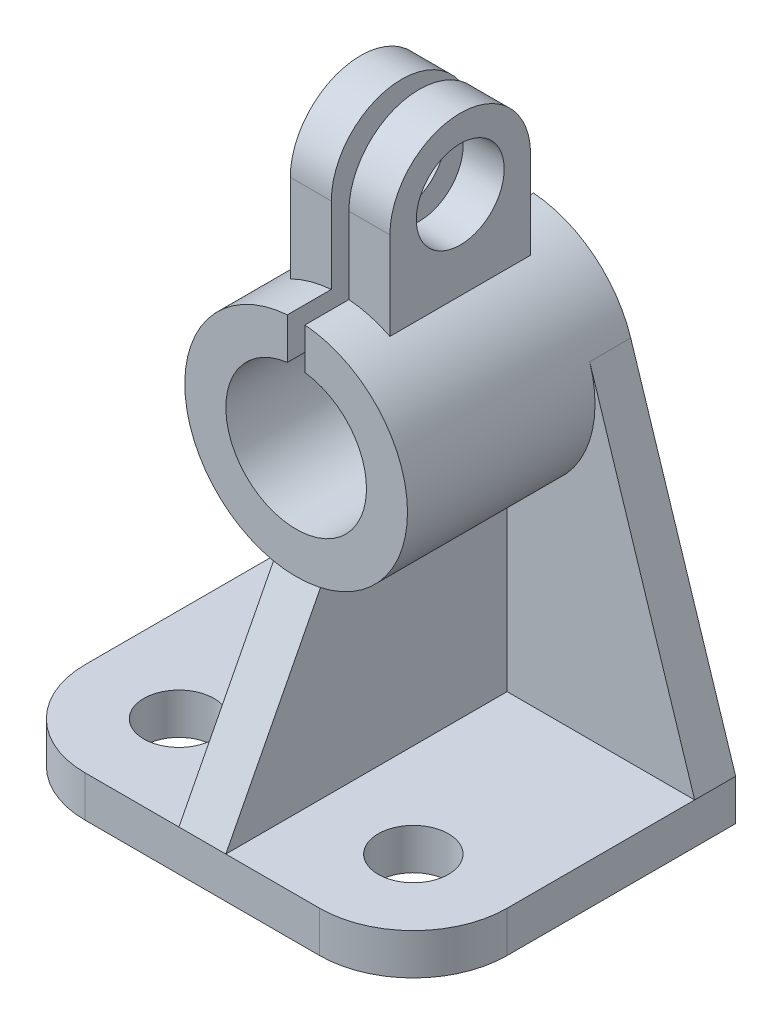
from build123d import *

# Parameters (mm, degrees)
SKETCH1_W                  = 72
SKETCH1_H                  = 7
BOSS_EXTRUDE1_DEPTH        = 55
BOSS_EXTRUDE2_DEPTH        = 7
BOSS_EXTRUDE3_DEPTH        = 39
BOSS_EXTRUDE4_START        = 7.5
BOSS_EXTRUDE4_DEPTH        = 24
FILLET1_RADIUS             = 12
FILLET1_LENGTH             = 7
FILLET2_RADIUS             = 12
FILLET2_LENGTH             = 7
F_1_0MM_DOWEL_HOLE1_D      = 15
RIB1_REACH                 = 119.589
SKETCH4_WALL_W             = 272.06418258
SKETCH4_WALL_H             = 8
FILLET3_R                  = 16
F_12_0MM_DOWEL_HOLE1_D     = 12
F_12_0MM_DOWEL_HOLE1_DEPTH = 7


with BuildPart() as part:
    # Sketch1 → Boss-Extrude1 (new body)
    with BuildSketch(Plane.XY):
        Rectangle(SKETCH1_W, SKETCH1_H)
    extrude(amount=BOSS_EXTRUDE1_DEPTH)

    # Sketch1<3> → Boss-Extrude2 (add)
    with BuildSketch(Plane.XY):
        with BuildLine():
            ThreePointArc((19, 53.5), (-2.93819909, 34.728559296), (-18.091261695, 59.305708421))
            Line((-18.091261695, 59.305708421), (-36, 3.5))
            Line((-36, 3.5), (36, 3.5))
            Line((36, 3.5), (18.091261695, 59.305708421))
            ThreePointArc((18.091261695, 59.305708421), (18.771440704, 56.43819909), (19, 53.5))
        make_face()
    extrude(amount=BOSS_EXTRUDE2_DEPTH)

    # Sketch1<4> → Boss-Extrude3 (add)
    with BuildSketch(Plane.XY):
        with BuildLine():
            ThreePointArc((-8.5, 70.492645468), (-14.424308987, 65.866863395), (-18.091261695, 59.305708421))
            ThreePointArc((-18.091261695, 59.305708421), (-2.93819909, 34.728559296), (19, 53.5))
            ThreePointArc((19, 53.5), (18.771440704, 56.43819909), (18.091261695, 59.305708421))
            ThreePointArc((18.091261695, 59.305708421), (14.424308987, 65.866863395), (8.5, 70.492645468))
            ThreePointArc((8.5, 70.492645468), (5.093989215, 71.80440586), (1.5, 72.440696925))
            Line((1.5, 72.440696925), (1.5, 65.4058809))
            ThreePointArc((1.5, 65.4058809), (9, 61.437253933), (12, 53.5))
            ThreePointArc((12, 53.5), (-7.937253933, 44.5), (-1.5, 65.4058809))
            Line((-1.5, 65.4058809), (-1.5, 72.440696925))
            ThreePointArc((-1.5, 72.440696925), (-5.093989215, 71.80440586), (-8.5, 70.492645468))
        make_face()
    extrude(amount=BOSS_EXTRUDE3_DEPTH)

    # Sketch1<5> → Boss-Extrude4 (add)
    with BuildSketch(Plane.XY.offset(BOSS_EXTRUDE4_START)):
        with BuildLine():
            Line((1.5, 97.5), (1.5, 72.440696925))
            ThreePointArc((1.5, 72.440696925), (5.093989215, 71.80440586), (8.5, 70.492645468))
            Line((8.5, 70.492645468), (8.5, 97.5))
            Line((8.5, 97.5), (1.5, 97.5))
        make_face()
        with BuildLine():
            Line((-8.5, 97.5), (-8.5, 70.492645468))
            ThreePointArc((-8.5, 70.492645468), (-5.093989215, 71.80440586), (-1.5, 72.440696925))
            Line((-1.5, 72.440696925), (-1.5, 97.5))
            Line((-1.5, 97.5), (-8.5, 97.5))
        make_face()
    extrude(amount=BOSS_EXTRUDE4_DEPTH)

    # Fillet1: full round fillet: the end face becomes a half cylinder, R = half its width
    fillet1_face = Plane((5, 97.5, 19.5), x_dir=(1, 0, 0), z_dir=(0, 1, 0))  # on the end face: x along it, z out of the body
    fillet1_slab = fillet1_face.offset(-FILLET1_RADIUS / 2) * Box(FILLET1_LENGTH, 2 * FILLET1_RADIUS, FILLET1_RADIUS, mode=Mode.PRIVATE)  # the body's end, R deep
    fillet1_round = Plane((5, 85.5, 19.5), x_dir=(0, 1, 0), z_dir=(1, 0, 0)) * Cylinder(FILLET1_RADIUS, FILLET1_LENGTH, mode=Mode.PRIVATE)  # its axis R under the face
    add(fillet1_slab - fillet1_round, mode=Mode.SUBTRACT)

    # Fillet2: full round fillet: the end face becomes a half cylinder, R = half its width
    fillet2_face = Plane((-5, 97.5, 19.5), x_dir=(-1, 0, 0), z_dir=(0, 1, 0))  # on the end face: x along it, z out of the body
    fillet2_slab = fillet2_face.offset(-FILLET2_RADIUS / 2) * Box(FILLET2_LENGTH, 2 * FILLET2_RADIUS, FILLET2_RADIUS, mode=Mode.PRIVATE)  # the body's end, R deep
    fillet2_round = Plane((-5, 85.5, 19.5), x_dir=(0, 1, 0), z_dir=(-1, 0, 0)) * Cylinder(FILLET2_RADIUS, FILLET2_LENGTH, mode=Mode.PRIVATE)  # its axis R under the face
    add(fillet2_slab - fillet2_round, mode=Mode.SUBTRACT)

    # Ø1.0mm Dowel Hole1 (through all)
    with Locations(Plane(origin=(8.5, 0, 0), x_dir=(0, 0, -1), z_dir=(1, 0, 0))):
        with Locations((-19.5, 85.5)):
            Hole(F_1_0MM_DOWEL_HOLE1_D / 2)

    # Sketch4 wall → Rib1 (add, up to next)
    with BuildSketch(Plane(origin=(0, 19, 47), x_dir=(0, -0.888620657055, 0.45864291977), z_dir=(0, -0.45864291977, -0.888620657055)), mode=Mode.PRIVATE) as rib1_sk1:
        Rectangle(SKETCH4_WALL_W, SKETCH4_WALL_H)
    rib1_tool1 = extrude(rib1_sk1.sketch, amount=RIB1_REACH, mode=Mode.PRIVATE) - part.part
    add(rib1_tool1.solids().sort_by_distance((0, 19, 47))[0])

    # Fillet3
    fillet3_edges = [part.edges().sort_by_distance(p)[0] for p in [
        (36, 0, 55),
        (-36, 0, 55),
    ]]
    fillet(fillet3_edges, radius=FILLET3_R)

    # Ø12.0mm Dowel Hole1
    with Locations(Plane(origin=(0, 3.5, 0), x_dir=(1, 0, 0), z_dir=(0, 1, 0))):
        with Locations((20, -39), (-20, -39)):
            Hole(F_12_0MM_DOWEL_HOLE1_D / 2, depth=F_12_0MM_DOWEL_HOLE1_DEPTH)


solid = part.part
